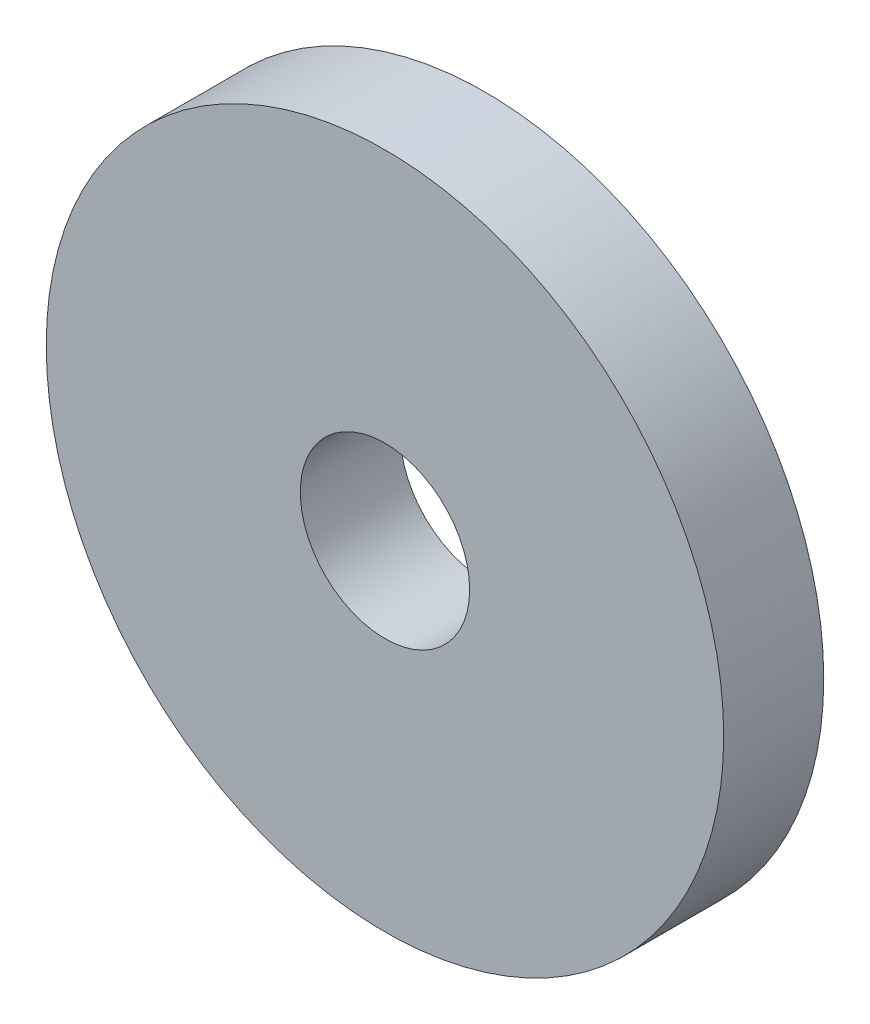
from build123d import *

# Parameters (mm, degrees)
SKETCH_1_R          = 150
EXTRUDE_1_DEPTH     = 29.535936744
SKETCH_2_R          = 25
CUT_EXTRUDE_2_DEPTH = 29.535936744
CUT_EXTRUDE_START   = -29.535936744
SKETCH_3_R          = 150
SKETCH_3_R_2        = 100
CUT_EXTRUDE_3_DEPTH = 29.535936744


with BuildPart() as part:
    # 草图1 → 凸台-拉伸1 (new body)
    with BuildSketch(Plane.XY):
        Circle(SKETCH_1_R)
    extrude(amount=EXTRUDE_1_DEPTH)

    # 草图2 → 切除-拉伸2 (cut)
    with BuildSketch(Plane.XY.offset(29.535936744)):
        Circle(SKETCH_2_R)
    extrude(amount=-CUT_EXTRUDE_2_DEPTH, mode=Mode.SUBTRACT)

    # 草图3 → 切除-拉伸3 (cut)
    with BuildSketch(Plane.XY.offset(29.535936744).offset(CUT_EXTRUDE_START)):
        Circle(SKETCH_3_R)
        Circle(SKETCH_3_R_2, mode=Mode.SUBTRACT)
    extrude(amount=CUT_EXTRUDE_3_DEPTH, mode=Mode.SUBTRACT)


solid = part.part
